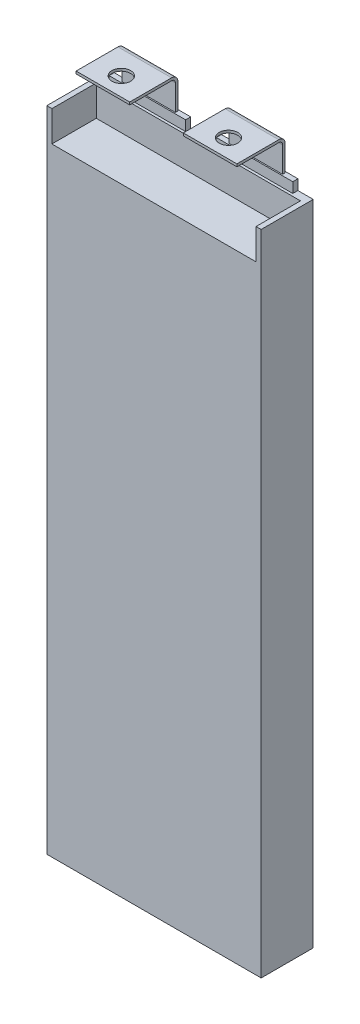
from build123d import *

# Parameters (mm, degrees)
SKETCH1_W                 = 42
SKETCH1_H                 = 127
BOSS_EXTRUDE1_DEPTH       = 5.1
SKETCH2_W                 = 40
SKETCH2_H                 = 6
CUT_EXTRUDE1_DEPTH        = 8.7
SKETCH3_W                 = 15
SKETCH3_H                 = 2
BOSS_EXTRUDE2_DEPTH       = 0.5
TAB_PROFILE_W             = 10.5
TAB_PROFILE_H             = 0.5
FILLET2_R                 = 0.75
FILLET1_R                 = 1.25
FILLET4_R                 = 0.75
FILLET3_R                 = 1.25
F_6_CLEARANCE_HOLE1_D     = 3.6576
F_6_CLEARANCE_HOLE1_DEPTH = 0.5
F_6_CLEARANCE_HOLE2_D     = 3.6576
F_6_CLEARANCE_HOLE2_DEPTH = 0.5


with BuildPart() as part:
    # Sketch1 → Boss-Extrude1 (new, symmetric)
    with BuildSketch(Plane.XY):
        with Locations((0, 63.5)):
            Rectangle(SKETCH1_W, SKETCH1_H)
    extrude(amount=BOSS_EXTRUDE1_DEPTH, both=True)

    # Sketch2 → Cut-Extrude1 (cut)
    with BuildSketch(Plane.XY.offset(5.1)):
        with Locations((0, 124)):
            Rectangle(SKETCH2_W, SKETCH2_H)
    extrude(amount=-CUT_EXTRUDE1_DEPTH, mode=Mode.SUBTRACT)

    # Sketch3 → Boss-Extrude2 (add, symmetric)
    with BuildSketch(Plane(origin=(0, 0, -4.6), x_dir=(-1, 0, 0), z_dir=(0, 0, -1))):
        with Locations((-10.5, 128)):
            Rectangle(SKETCH3_W, SKETCH3_H)
        with Locations((10.5, 128)):
            Rectangle(SKETCH3_W, SKETCH3_H)
    extrude(amount=BOSS_EXTRUDE2_DEPTH, both=True)

    # Tabs: sweep along a path in Tab Bend
    with BuildLine(Plane(origin=(0, 0, 0), x_dir=(0, 0, -1), z_dir=(1, 0, 0))) as tabs_path:
        Line((4.6, 129), (4.6, 135))
        Line((4.6, 135), (-4.6, 135))
    # Tab Profile → Tabs (sweep)
    with BuildSketch(Plane(origin=(0, 129, 0), x_dir=(1, 0, 0), z_dir=(0, 1, 0))):
        with Locations((-10.5, 4.6)):
            Rectangle(TAB_PROFILE_W, TAB_PROFILE_H)
        with Locations((10.5, 4.6)):
            Rectangle(TAB_PROFILE_W, TAB_PROFILE_H)
    sweep(path=tabs_path.line, transition=Transition.RIGHT)

    # Fillet2
    fillet2_edges = [part.edges().sort_by_distance(p)[0] for p in [
        (10.5, 134.75, -4.35),
    ]]
    fillet(fillet2_edges, radius=FILLET2_R)

    # Fillet1
    fillet1_edges = [part.edges().sort_by_distance(p)[0] for p in [
        (10.5, 135.25, -4.85),
    ]]
    fillet(fillet1_edges, radius=FILLET1_R)

    # Fillet4
    fillet4_edges = [part.edges().sort_by_distance(p)[0] for p in [
        (-10.5, 134.75, -4.35),
    ]]
    fillet(fillet4_edges, radius=FILLET4_R)

    # Fillet3
    fillet3_edges = [part.edges().sort_by_distance(p)[0] for p in [
        (-10.5, 135.25, -4.85),
    ]]
    fillet(fillet3_edges, radius=FILLET3_R)

    # #6 Clearance Hole1
    with Locations(Plane(origin=(0, 135.25, 0), x_dir=(1, 0, 0), z_dir=(0, 1, 0))):
        with Locations((-10.5, -1)):
            Hole(F_6_CLEARANCE_HOLE1_D / 2, depth=F_6_CLEARANCE_HOLE1_DEPTH)

    # #6 Clearance Hole2
    with Locations(Plane(origin=(0, 135.25, 0), x_dir=(1, 0, 0), z_dir=(0, 1, 0))):
        with Locations((10.5, -1)):
            Hole(F_6_CLEARANCE_HOLE2_D / 2, depth=F_6_CLEARANCE_HOLE2_DEPTH)


solid = part.part
